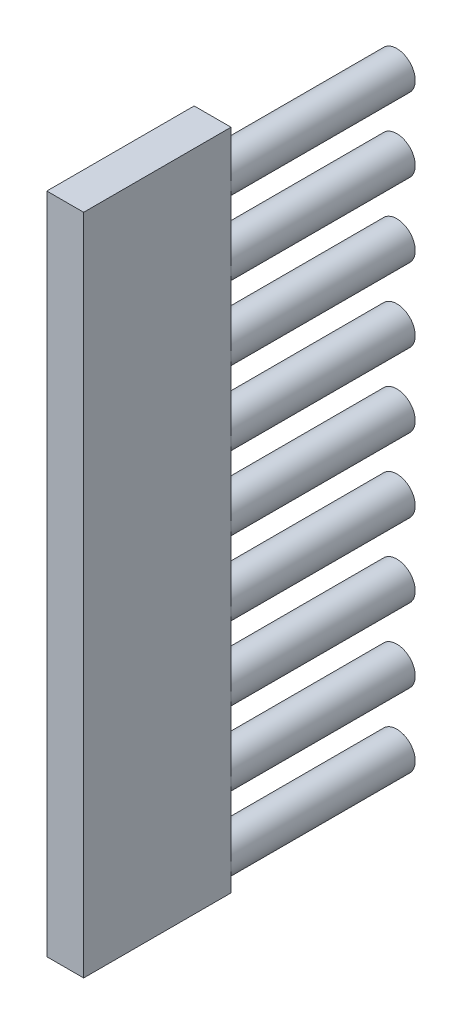
from build123d import *

# Parameters (mm, degrees)
SKETCH1_W           = 90
SKETCH1_H           = 20
BOSS_EXTRUDE1_DEPTH = 5
SKETCH2_R           = 2.5
BOSS_EXTRUDE2_DEPTH = 25


with BuildPart() as part:
    # Sketch1 → Boss-Extrude1 (new body)
    with BuildSketch(Plane.YZ):
        with Locations((45, 10)):
            Rectangle(SKETCH1_W, SKETCH1_H)
    extrude(amount=BOSS_EXTRUDE1_DEPTH)

    # Sketch2 → Boss-Extrude2 (add)
    with BuildSketch(Plane(origin=(0, 0, 0), x_dir=(1, 0, 0), z_dir=(0, 0, -1))):
        with Locations(Location((2.5, -3, 0), (0, 0, 180))):
            Circle(SKETCH2_R)
        with Locations(Location((2.5, -13, 0), (0, 0, 180))):
            Circle(SKETCH2_R)
        with Locations(Location((2.5, -23, 0), (0, 0, 180))):
            Circle(SKETCH2_R)
        with Locations(Location((2.5, -33, 0), (0, 0, 180))):
            Circle(SKETCH2_R)
        with Locations(Location((2.5, -43, 0), (0, 0, 180))):
            Circle(SKETCH2_R)
        with Locations(Location((2.5, -53, 0), (0, 0, 180))):
            Circle(SKETCH2_R)
        with Locations(Location((2.5, -63, 0), (0, 0, 180))):
            Circle(SKETCH2_R)
        with Locations(Location((2.5, -73, 0), (0, 0, 180))):
            Circle(SKETCH2_R)
        with Locations(Location((2.5, -83, 0), (0, 0, 180))):
            Circle(SKETCH2_R)
    extrude(amount=BOSS_EXTRUDE2_DEPTH)


solid = part.part
